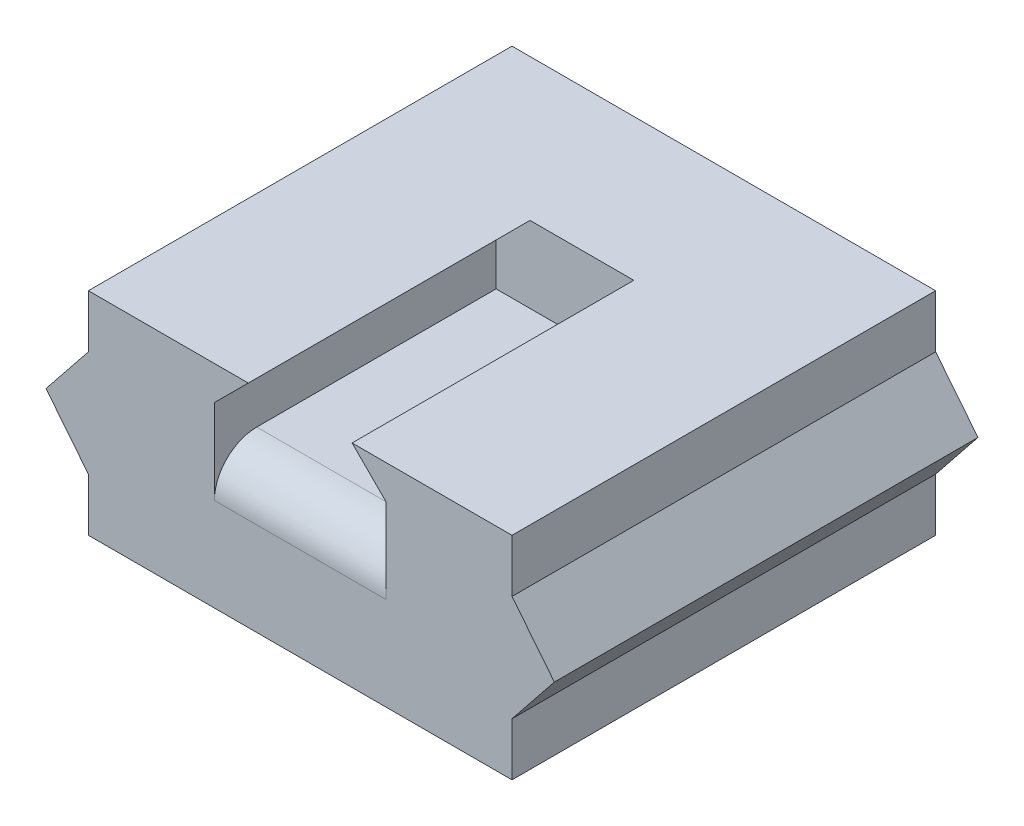
from build123d import *

# Parameters (mm, degrees)
SKETCH_1_W          = 10
SKETCH_1_H          = 10
EXTRUDE_1_DEPTH     = 5
EXTRUDE_2_DEPTH     = 10
SKETCH_3_W          = 4.05
SKETCH_3_H          = 3.3
CUT_EXTRUDE_1_DEPTH = 1.8
SKETCH_4_W          = 4.05
SKETCH_4_H          = 1.8
CUT_EXTRUDE_2_DEPTH = 11.257801909
FILLET_1_R          = 1
EXTRUDE_3_DEPTH     = 6.65


with BuildPart() as part:
    # 草图1 → 凸台-拉伸1 (new body)
    with BuildSketch(Plane(origin=(0, 0, 0), x_dir=(1, 0, 0), z_dir=(0, 1, 0))):
        Rectangle(SKETCH_1_W, SKETCH_1_H)
    extrude(amount=EXTRUDE_1_DEPTH)

    # 草图2 → 凸台-拉伸2 (add)
    with BuildSketch(Plane(origin=(0, 0, -5), x_dir=(-1, 0, 0), z_dir=(0, 0, -1))):
        Polygon((5, 1.25), (5, 3.75), (6, 2.5), align=None)
        Polygon((-5, 1.25), (-5, 3.75), (-6, 2.5), align=None)
    extrude(amount=-EXTRUDE_2_DEPTH)

    # 草图3 → 切除-拉伸1 (cut)
    with BuildSketch(Plane(origin=(0, 5, 0), x_dir=(1, 0, 0), z_dir=(0, 1, 0))):
        Rectangle(SKETCH_3_W, SKETCH_3_H)
    extrude(amount=-CUT_EXTRUDE_1_DEPTH, mode=Mode.SUBTRACT)

    # 草图4 → 切除-拉伸2 (cut, through all)
    with BuildSketch(Plane(origin=(0, 0, 1.65), x_dir=(-1, 0, 0), z_dir=(0, 0, -1))):
        with Locations((0, 4.1)):
            Rectangle(SKETCH_4_W, SKETCH_4_H)
    extrude(amount=-CUT_EXTRUDE_2_DEPTH, mode=Mode.SUBTRACT)

    # 圆角1
    fillet_1_edges = [part.edges().sort_by_distance(p)[0] for p in [
        (0, 3.2, 5),
    ]]
    fillet(fillet_1_edges, radius=FILLET_1_R)

    # 草图5 → 凸台-拉伸3 (add)
    with BuildSketch(Plane.XY.offset(-1.65)):
        Polygon((2.025, 5), (2.025, 4.2), (1.225, 5), align=None)
        Polygon((-2.025, 4.2), (-1.225, 5), (-2.025, 5), align=None)
    extrude(amount=EXTRUDE_3_DEPTH)


solid = part.part
